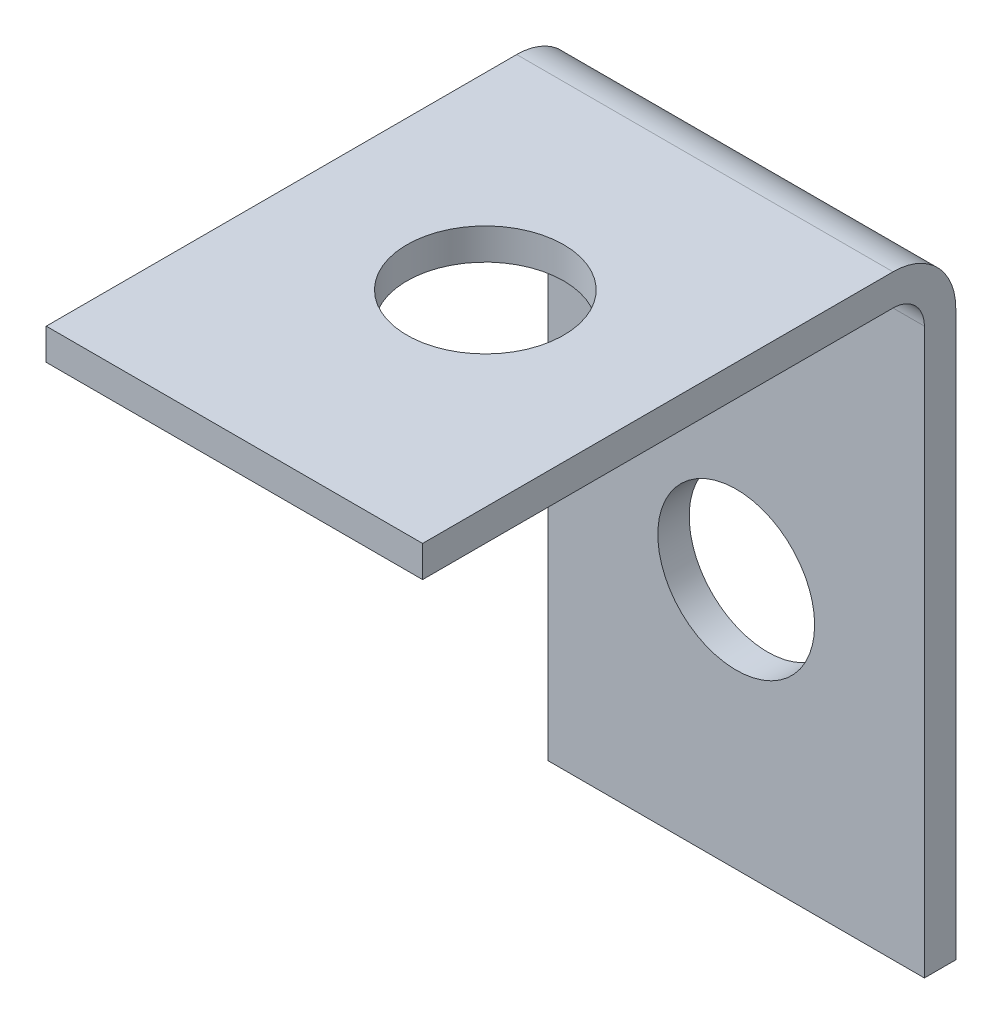
from build123d import *

# Parameters (mm, degrees)
CROQUIS1_W              = 12
CROQUIS1_H              = 20
CROQUIS1_R              = 2.5
SALIENTE_EXTRUIR1_DEPTH = 1
CROQUIS2_W              = 12
CROQUIS2_H              = 1
SALIENTE_EXTRUIR2_DEPTH = 16
CROQUIS3_R              = 2.5
CORTAR_EXTRUIR1_DEPTH   = 8
REDONDEO2_R             = 1
REDONDEO3_R             = 2


with BuildPart() as part:
    # Croquis1 → Saliente-Extruir1 (new body)
    with BuildSketch(Plane.XY):
        with Locations((0, -10)):
            Rectangle(CROQUIS1_W, CROQUIS1_H)
        with Locations((0, -12)):
            Circle(CROQUIS1_R, mode=Mode.SUBTRACT)
    extrude(amount=SALIENTE_EXTRUIR1_DEPTH)

    # Croquis2 → Saliente-Extruir2 (add)
    with BuildSketch(Plane.XY.offset(1)):
        with Locations((0, -0.5)):
            Rectangle(CROQUIS2_W, CROQUIS2_H)
    extrude(amount=SALIENTE_EXTRUIR2_DEPTH)

    # Croquis3 → Cortar-Extruir1 (cut)
    with BuildSketch(Plane.XZ.offset(1)):
        with Locations(Location((0, 9, 0), (0, 0, 270))):
            Circle(CROQUIS3_R)
    extrude(amount=-CORTAR_EXTRUIR1_DEPTH, mode=Mode.SUBTRACT)

    # Redondeo2
    redondeo2_edges = [part.edges().sort_by_distance(p)[0] for p in [
        (0, -1, 1),
    ]]
    fillet(redondeo2_edges, radius=REDONDEO2_R)

    # Redondeo3
    redondeo3_edges = [part.edges().sort_by_distance(p)[0] for p in [
        (0, 0, 0),
    ]]
    fillet(redondeo3_edges, radius=REDONDEO3_R)


solid = part.part
